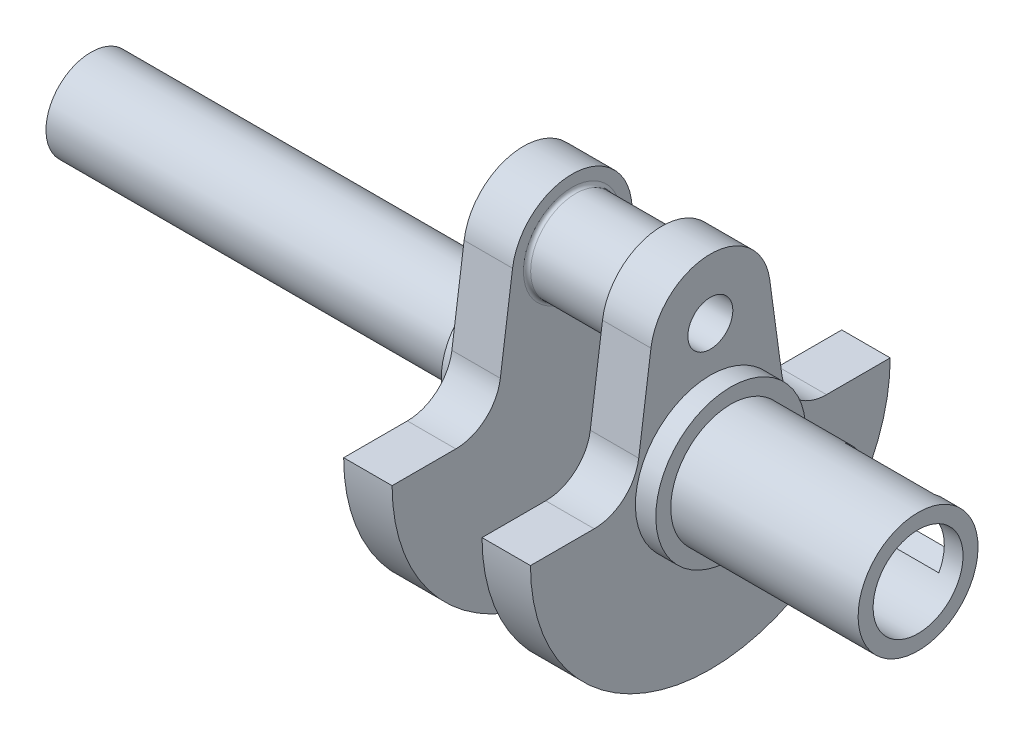
from build123d import *

# Parameters (mm, degrees)
SKETCH2_W                      = 9.525
SKETCH2_H                      = 4.75615
CUT_EXTRUDE1_REACH             = 69.93
SKETCH4_W                      = 9.525
SKETCH4_H                      = 7.14375
CUT_EXTRUDE1_DIRECTION_2_DEPTH = 68.929971613
FILLET1_R                      = 0.381
CUT_EXTRUDE2_DEPTH             = 71.918317263
CUT_EXTRUDE2_DEPTH_BACK        = 71.918317263
F_3_16_0_1875_DIAMETER_HOLE1_D = 4.7625


with BuildPart() as part:
    # Sketch1 → Revolve1 (revolve)
    with BuildSketch(Plane.XY):
        Polygon((-43.65625, 0), (-43.65625, 4.7625), (0, 4.7625), (0, 6.5484375), (2.159, 6.5484375), (2.159, 19.05), (7.2898, 19.05), (7.2898, 0), align=None)
        Polygon((16.8148, 4.7625), (16.8148, 19.05), (21.9456, 19.05), (21.9456, 7.9375), (24.1046, 7.9375), (24.1046, 6.35), (43.94835, 6.35), (43.94835, 4.7625), align=None)
    revolve(axis=Axis((0, 0, 0), (-1, 0, 0)))

    # Sketch2 → Revolve2 (revolve)
    with BuildSketch(Plane.XY, mode=Mode.PRIVATE) as revolve2_sk:
        with Locations((12.0523, 15.078075)):
            Rectangle(SKETCH2_W, SKETCH2_H)
    revolve(revolve2_sk.sketch.rotate(Axis((-15.553486907, 12.7, 0), (1, 0, 0)), 90), axis=Axis((-15.553486907, 12.7, 0), (1, 0, 0)))

    # Sketch4 → Cut-Extrude1 (cut, up to next)
    with BuildSketch(Plane(origin=(7.2898, 6.51548373, -17.901144426), x_dir=(-1, 0, 0), z_dir=(0, 0.34202014332566627, -0.9396926207859093)), mode=Mode.PRIVATE) as cut_extrude1_sk1:
        with Locations((-29.911675, 0)):
            Rectangle(SKETCH4_W, SKETCH4_H)
    cut_extrude1_tool1 = extrude(cut_extrude1_sk1.sketch, amount=-CUT_EXTRUDE1_REACH, mode=Mode.PRIVATE) & part.part
    add(cut_extrude1_tool1.solids().sort_by_distance((37.201475, 6.515484, -17.901144))[0], mode=Mode.SUBTRACT)

    # Sketch4 → Cut-Extrude1 direction 2 (cut)
    with BuildSketch(Plane(origin=(7.2898, 6.51548373, -17.901144426), x_dir=(-1, 0, 0), z_dir=(0, 0.34202014332566627, -0.9396926207859093))):
        with Locations((-29.911675, 0)):
            Rectangle(SKETCH4_W, SKETCH4_H)
    extrude(amount=CUT_EXTRUDE1_DIRECTION_2_DEPTH, mode=Mode.SUBTRACT)

    # Fillet1
    fillet1_edges = [part.edges().sort_by_distance(p)[0] for p in [
        (7.2898, 12.7, -4.75615),
        (16.8148, 12.7, -4.75615),
    ]]
    fillet(fillet1_edges, radius=FILLET1_R)

    # Sketch5 → Cut-Extrude2 (cut, two sides: drawn at the far end of the back side and taken through both)
    with BuildSketch(Plane(origin=(21.9456, 0, 0), x_dir=(0, 0, -1), z_dir=(1, 0, 0)).offset(-CUT_EXTRUDE2_DEPTH_BACK)):
        with BuildLine():
            ThreePointArc((-6.291289262, 13.561498357), (-4.174445198, 17.485029497), (2e-09, 19.05))
            ThreePointArc((2e-09, 19.05), (-13.470384181, 13.470384182), (-19.05, 0))
            Line((-19.05, 0), (-12.303125, 0))
            ThreePointArc((-12.303125, 0), (-9.172291101, 1.173727878), (-7.584658053, 4.116376233))
            Line((-7.584658053, 4.116376233), (-6.291289262, 13.561498357))
        make_face()
        with BuildLine():
            ThreePointArc((7.584658053, 4.116376233), (9.172291101, 1.173727878), (12.303125, 0))
            Line((12.303125, 0), (19.05, 0))
            ThreePointArc((19.05, 0), (13.470384182, 13.470384181), (2e-09, 19.05))
            ThreePointArc((2e-09, 19.05), (4.1744452, 17.485029496), (6.291289262, 13.561498357))
            Line((6.291289262, 13.561498357), (7.584658053, 4.116376233))
        make_face()
    extrude(amount=CUT_EXTRUDE2_DEPTH + CUT_EXTRUDE2_DEPTH_BACK, mode=Mode.SUBTRACT)

    # 3/16 (0.1875) Diameter Hole1 (through all)
    with Locations(Plane.ZY.offset(-2.159)):
        with Locations((0, 12.7)):
            Hole(F_3_16_0_1875_DIAMETER_HOLE1_D / 2)


solid = part.part
